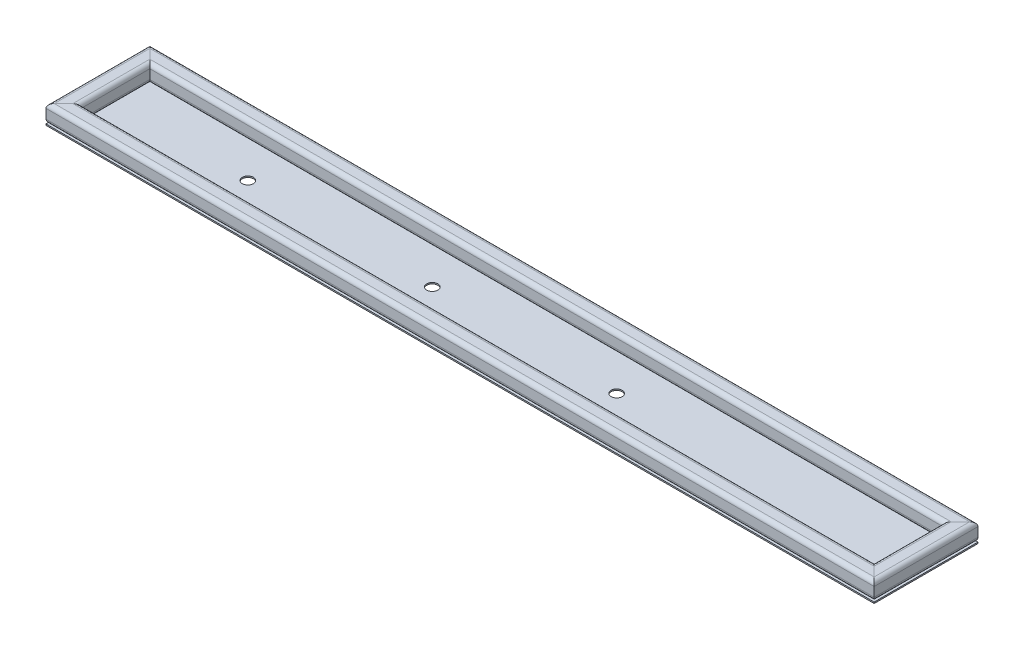
from build123d import *

# Parameters (mm, degrees)
TUBO_CUADRADO_2_X_2_X_0_25_1_DEPTH      = 186.921024484
TUBO_CUADRADO_2_X_2_X_0_25_1_DEPTH_BACK = 36.921024484
TUBO_CUADRADO_2_X_2_X_0_25_1_2_DEPTH    = 1270.242048969
TUBO_CUADRADO_2_X_2_X_0_25_1_3_DEPTH    = 223.842048969
TUBO_CUADRADO_2_X_2_X_0_25_1_4_DEPTH    = 1270.242048969
CROQUIS3_W                              = 1196.4
CROQUIS3_H                              = 150
SALIENTE_EXTRUIR1_DEPTH                 = 1.9
CROQUIS5_R                              = 8
CORTAR_EXTRUIR1_DEPTH                   = 10


with BuildPart() as part:
    # Sketch1 → Tubo cuadrado 2 X 2 X 0.25(1) (new, two sides: drawn at the far end of the back side and taken through both)
    with BuildSketch(Plane(origin=(-585.5, 12.7, -75), x_dir=(1, 0, 0), z_dir=(0, 0, 1)).offset(-TUBO_CUADRADO_2_X_2_X_0_25_1_DEPTH_BACK)):
        with BuildLine():
            Line((-6.7, -12.7), (6.7, -12.7))
            ThreePointArc((6.7, -12.7), (10.942640687, -10.942640687), (12.7, -6.7))
            Line((12.7, -6.7), (12.7, 6.7))
            ThreePointArc((12.7, 6.7), (10.942640687, 10.942640687), (6.7, 12.7))
            Line((6.7, 12.7), (-6.7, 12.7))
            ThreePointArc((-6.7, 12.7), (-10.942640687, 10.942640687), (-12.7, 6.7))
            Line((-12.7, 6.7), (-12.7, -6.7))
            ThreePointArc((-12.7, -6.7), (-10.942640687, -10.942640687), (-6.7, -12.7))
        make_face()
        with BuildLine():
            Line((-6.7, -9.7), (6.7, -9.7))
            ThreePointArc((6.7, -9.7), (8.821320344, -8.821320344), (9.7, -6.7))
            Line((9.7, -6.7), (9.7, 6.7))
            ThreePointArc((9.7, 6.7), (8.821320344, 8.821320344), (6.7, 9.7))
            Line((6.7, 9.7), (-6.7, 9.7))
            ThreePointArc((-6.7, 9.7), (-8.821320344, 8.821320344), (-9.7, 6.7))
            Line((-9.7, 6.7), (-9.7, -6.7))
            ThreePointArc((-9.7, -6.7), (-8.821320344, -8.821320344), (-6.7, -9.7))
        make_face(mode=Mode.SUBTRACT)
    extrude(amount=TUBO_CUADRADO_2_X_2_X_0_25_1_DEPTH + TUBO_CUADRADO_2_X_2_X_0_25_1_DEPTH_BACK)

    # Tubo cuadrado 2 X 2 X 0.25(1) mitre 1
    split(bisect_by=Plane(origin=(-598.2, 0, -75), x_dir=(0, -1, 0), z_dir=(-0.707106781, 0, 0.707106781)), keep=Keep.TOP)

    # Tubo cuadrado 2 X 2 X 0.25(1) mitre 2
    split(bisect_by=Plane(origin=(-598.2, 0, 75), x_dir=(0, -1, 0), z_dir=(-0.707106781, 0, -0.707106781)), keep=Keep.TOP)


with BuildPart() as body_2:
    # Sketch1 on segment 2 (carried to segment 2) → Tubo cuadrado 2 X 2 X 0.25_1 2 (new body)
    with BuildSketch(Plane(origin=(-635.121024484, 12.7, 62.3), x_dir=(0, 0, -1), z_dir=(1, 0, 0))):
        with BuildLine():
            Line((-6.7, -12.7), (6.7, -12.7))
            ThreePointArc((6.7, -12.7), (10.942640687, -10.942640687), (12.7, -6.7))
            Line((12.7, -6.7), (12.7, 6.7))
            ThreePointArc((12.7, 6.7), (10.942640687, 10.942640687), (6.7, 12.7))
            Line((6.7, 12.7), (-6.7, 12.7))
            ThreePointArc((-6.7, 12.7), (-10.942640687, 10.942640687), (-12.7, 6.7))
            Line((-12.7, 6.7), (-12.7, -6.7))
            ThreePointArc((-12.7, -6.7), (-10.942640687, -10.942640687), (-6.7, -12.7))
        make_face()
        with BuildLine():
            Line((-6.7, -9.7), (6.7, -9.7))
            ThreePointArc((6.7, -9.7), (8.821320344, -8.821320344), (9.7, -6.7))
            Line((9.7, -6.7), (9.7, 6.7))
            ThreePointArc((9.7, 6.7), (8.821320344, 8.821320344), (6.7, 9.7))
            Line((6.7, 9.7), (-6.7, 9.7))
            ThreePointArc((-6.7, 9.7), (-8.821320344, 8.821320344), (-9.7, 6.7))
            Line((-9.7, 6.7), (-9.7, -6.7))
            ThreePointArc((-9.7, -6.7), (-8.821320344, -8.821320344), (-6.7, -9.7))
        make_face(mode=Mode.SUBTRACT)
    extrude(amount=TUBO_CUADRADO_2_X_2_X_0_25_1_2_DEPTH)

    # Tubo cuadrado 2 X 2 X 0.25_1 2 mitre 1
    split(bisect_by=Plane(origin=(-598.2, 0, 75), x_dir=(0, 1, 0), z_dir=(0.707106781, 0, 0.707106781)), keep=Keep.TOP)

    # Tubo cuadrado 2 X 2 X 0.25_1 2 mitre 2
    split(bisect_by=Plane(origin=(598.2, 0, 75), x_dir=(0, -1, 0), z_dir=(-0.707106781, 0, 0.707106781)), keep=Keep.TOP)


with BuildPart() as body_3:
    # Sketch1 on segment 3 (carried to segment 3) → Tubo cuadrado 2 X 2 X 0.25_1 3 (new body)
    with BuildSketch(Plane(origin=(585.5, 12.7, 111.921024484), x_dir=(-1, 0, 0), z_dir=(0, 0, -1))):
        with BuildLine():
            Line((-6.7, -12.7), (6.7, -12.7))
            ThreePointArc((6.7, -12.7), (10.942640687, -10.942640687), (12.7, -6.7))
            Line((12.7, -6.7), (12.7, 6.7))
            ThreePointArc((12.7, 6.7), (10.942640687, 10.942640687), (6.7, 12.7))
            Line((6.7, 12.7), (-6.7, 12.7))
            ThreePointArc((-6.7, 12.7), (-10.942640687, 10.942640687), (-12.7, 6.7))
            Line((-12.7, 6.7), (-12.7, -6.7))
            ThreePointArc((-12.7, -6.7), (-10.942640687, -10.942640687), (-6.7, -12.7))
        make_face()
        with BuildLine():
            Line((-6.7, -9.7), (6.7, -9.7))
            ThreePointArc((6.7, -9.7), (8.821320344, -8.821320344), (9.7, -6.7))
            Line((9.7, -6.7), (9.7, 6.7))
            ThreePointArc((9.7, 6.7), (8.821320344, 8.821320344), (6.7, 9.7))
            Line((6.7, 9.7), (-6.7, 9.7))
            ThreePointArc((-6.7, 9.7), (-8.821320344, 8.821320344), (-9.7, 6.7))
            Line((-9.7, 6.7), (-9.7, -6.7))
            ThreePointArc((-9.7, -6.7), (-8.821320344, -8.821320344), (-6.7, -9.7))
        make_face(mode=Mode.SUBTRACT)
    extrude(amount=TUBO_CUADRADO_2_X_2_X_0_25_1_3_DEPTH)

    # Tubo cuadrado 2 X 2 X 0.25_1 3 mitre 1
    split(bisect_by=Plane(origin=(598.2, 0, -75), x_dir=(0, 1, 0), z_dir=(0.707106781, 0, 0.707106781)), keep=Keep.TOP)

    # Tubo cuadrado 2 X 2 X 0.25_1 3 mitre 2
    split(bisect_by=Plane(origin=(598.2, 0, 75), x_dir=(0, 1, 0), z_dir=(0.707106781, 0, -0.707106781)), keep=Keep.TOP)


with BuildPart() as body_4:
    # Sketch1 on segment 4 (carried to segment 4) → Tubo cuadrado 2 X 2 X 0.25_1 4 (new body)
    with BuildSketch(Plane(origin=(635.121024484, 12.7, -62.3), x_dir=(0, 0, 1), z_dir=(-1, 0, 0))):
        with BuildLine():
            Line((-6.7, -12.7), (6.7, -12.7))
            ThreePointArc((6.7, -12.7), (10.942640687, -10.942640687), (12.7, -6.7))
            Line((12.7, -6.7), (12.7, 6.7))
            ThreePointArc((12.7, 6.7), (10.942640687, 10.942640687), (6.7, 12.7))
            Line((6.7, 12.7), (-6.7, 12.7))
            ThreePointArc((-6.7, 12.7), (-10.942640687, 10.942640687), (-12.7, 6.7))
            Line((-12.7, 6.7), (-12.7, -6.7))
            ThreePointArc((-12.7, -6.7), (-10.942640687, -10.942640687), (-6.7, -12.7))
        make_face()
        with BuildLine():
            Line((-6.7, -9.7), (6.7, -9.7))
            ThreePointArc((6.7, -9.7), (8.821320344, -8.821320344), (9.7, -6.7))
            Line((9.7, -6.7), (9.7, 6.7))
            ThreePointArc((9.7, 6.7), (8.821320344, 8.821320344), (6.7, 9.7))
            Line((6.7, 9.7), (-6.7, 9.7))
            ThreePointArc((-6.7, 9.7), (-8.821320344, 8.821320344), (-9.7, 6.7))
            Line((-9.7, 6.7), (-9.7, -6.7))
            ThreePointArc((-9.7, -6.7), (-8.821320344, -8.821320344), (-6.7, -9.7))
        make_face(mode=Mode.SUBTRACT)
    extrude(amount=TUBO_CUADRADO_2_X_2_X_0_25_1_4_DEPTH)

    # Tubo cuadrado 2 X 2 X 0.25_1 4 mitre 1
    split(bisect_by=Plane(origin=(-598.2, 0, -75), x_dir=(0, 1, 0), z_dir=(0.707106781, 0, -0.707106781)), keep=Keep.TOP)

    # Tubo cuadrado 2 X 2 X 0.25_1 4 mitre 2
    split(bisect_by=Plane(origin=(598.2, 0, -75), x_dir=(0, -1, 0), z_dir=(-0.707106781, 0, -0.707106781)), keep=Keep.TOP)


with BuildPart() as body_5:
    # Croquis3 → Saliente-Extruir1 (new body)
    with BuildSketch(Plane.XZ):
        Rectangle(CROQUIS3_W, CROQUIS3_H)
    extrude(amount=SALIENTE_EXTRUIR1_DEPTH)

    # Croquis5 → Cortar-Extruir1 (cut)
    with BuildSketch(Plane(origin=(0, 0, 0), x_dir=(1, 0, 0), z_dir=(0, 1, 0))):
        with Locations(Location((151.222795334, 0, 0), (0, 0, 180))):
            Circle(CROQUIS5_R)
        with Locations(Location((-115.175, 0, 0), (0, 0, 180))):
            Circle(CROQUIS5_R)
        with Locations(Location((-381.572933, 0, 0), (0, 0, 180))):
            Circle(CROQUIS5_R)
    extrude(amount=-CORTAR_EXTRUIR1_DEPTH, mode=Mode.SUBTRACT)


solid = Compound([part.part, body_2.part, body_3.part, body_4.part, body_5.part])
